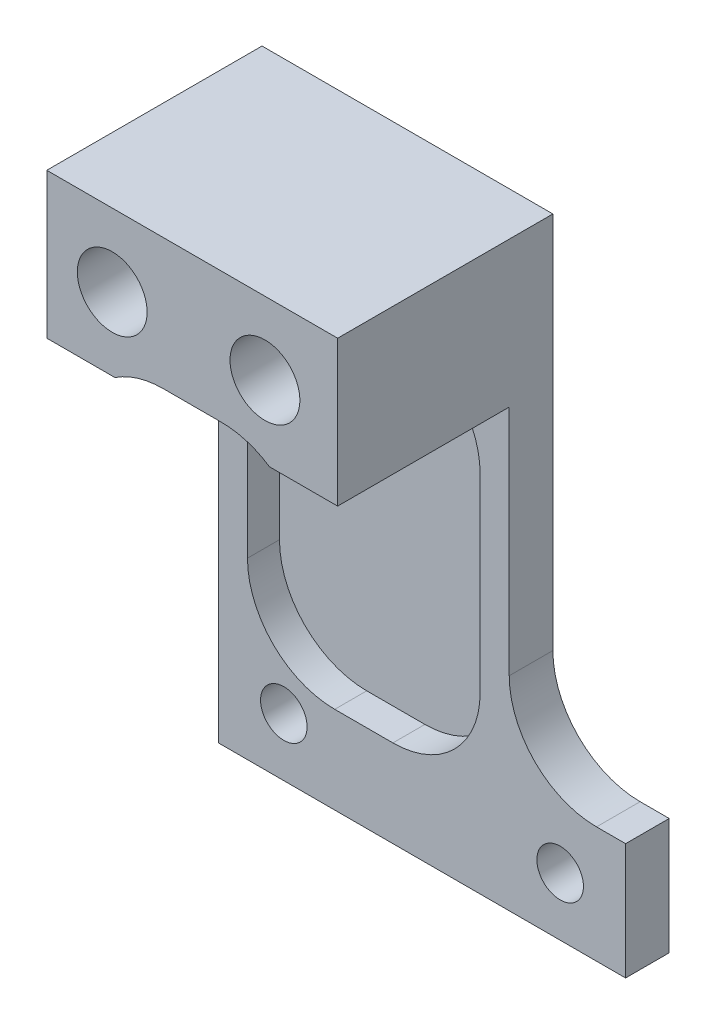
from build123d import *

# Parameters (mm, degrees)
SKETCH1_W                                           = 14
SKETCH1_H                                           = 20
BOSS_EXTRUDE1_DEPTH                                 = 1.5
SKETCH2_W                                           = 14
SKETCH2_H                                           = 5
BOSS_EXTRUDE2_DEPTH                                 = 5.9
M2_TAPPED_HOLE1_D                                   = 1.6
M2_TAPPED_HOLE1_DEPTH                               = 6
M2_TAPPED_HOLE1_TIP                                 = 0.480688495
CUT_EXTRUDE6_DEPTH                                  = 15.274452704
CBORE_FOR_M2_HEX_SOCKET_HEAD_CAP_SCREW1_D           = 2.4
CBORE_FOR_M2_HEX_SOCKET_HEAD_CAP_SCREW1_DEPTH       = 7.5
CBORE_FOR_M2_HEX_SOCKET_HEAD_CAP_SCREW1_CBORE_D     = 4.4
CBORE_FOR_M2_HEX_SOCKET_HEAD_CAP_SCREW1_CBORE_DEPTH = 2.4
CBORE_FOR_M2_HEX_SOCKET_HEAD_CAP_SCREW1_TIP         = 0.721032743
CUT_EXTRUDE7_DEPTH                                  = 7


with BuildPart() as part:
    # Sketch1 → Boss-Extrude1 (new body)
    with BuildSketch(Plane.XY):
        Rectangle(SKETCH1_W, SKETCH1_H)
    extrude(amount=BOSS_EXTRUDE1_DEPTH)

    # Sketch2 → Boss-Extrude2 (add)
    with BuildSketch(Plane.XY.offset(1.5)):
        with Locations((0, 7.5)):
            Rectangle(SKETCH2_W, SKETCH2_H)
    extrude(amount=BOSS_EXTRUDE2_DEPTH)

    # M2 Tapped Hole1
    with Locations(Plane(origin=(-4.75, -8, 0), x_dir=(-1, 0, 0), z_dir=(0, 0, -1))):
        with Locations((0, 0), (-9.5, 0)):
            Hole(M2_TAPPED_HOLE1_D / 2, depth=M2_TAPPED_HOLE1_DEPTH)
            with Locations((0, 0, -(M2_TAPPED_HOLE1_DEPTH + M2_TAPPED_HOLE1_TIP / 2))):  # 118° drill point
                Cone(0, M2_TAPPED_HOLE1_D / 2, M2_TAPPED_HOLE1_TIP, mode=Mode.SUBTRACT)

    # Sketch11 → Cut-Extrude6 (cut, through all)
    with BuildSketch(Plane.XY.offset(7.4)):
        with BuildLine():
            Line((7, -6), (6, -6))
            ThreePointArc((6, -6), (3.878679656, -5.121320344), (3, -3))
            Line((3, -3), (3, 10))
            Line((3, 10), (7, 10))
            Line((7, 10), (7, -6))
        make_face()
    extrude(amount=-CUT_EXTRUDE6_DEPTH, mode=Mode.SUBTRACT)

    # CBORE for M2 Hex Socket Head Cap Screw1
    with Locations(Plane(origin=(-4.75, 7.5, 0), x_dir=(-1, 0, 0), z_dir=(0, 0, -1))):
        with Locations((0, 0), (-5.25, 0)):
            CounterBoreHole(CBORE_FOR_M2_HEX_SOCKET_HEAD_CAP_SCREW1_D / 2, CBORE_FOR_M2_HEX_SOCKET_HEAD_CAP_SCREW1_CBORE_D / 2, CBORE_FOR_M2_HEX_SOCKET_HEAD_CAP_SCREW1_CBORE_DEPTH, depth=CBORE_FOR_M2_HEX_SOCKET_HEAD_CAP_SCREW1_DEPTH)
            with Locations((0, 0, -(CBORE_FOR_M2_HEX_SOCKET_HEAD_CAP_SCREW1_DEPTH + CBORE_FOR_M2_HEX_SOCKET_HEAD_CAP_SCREW1_TIP / 2))):  # 118° drill point
                Cone(0, CBORE_FOR_M2_HEX_SOCKET_HEAD_CAP_SCREW1_D / 2, CBORE_FOR_M2_HEX_SOCKET_HEAD_CAP_SCREW1_TIP, mode=Mode.SUBTRACT)

    # Sketch14 → Cut-Extrude7 (cut)
    with BuildSketch(Plane.XY.offset(7.4)):
        with BuildLine():
            Line((-3, 5.5), (-1, 5.5))
            ThreePointArc((-1, 5.5), (1.121320344, 4.621320344), (2, 2.5))
            Line((2, 2.5), (2, -4))
            ThreePointArc((2, -4), (1.121320344, -6.121320344), (-1, -7))
            Line((-1, -7), (-3, -7))
            ThreePointArc((-3, -7), (-5.121320344, -6.121320344), (-6, -4))
            Line((-6, -4), (-6, 2.5))
            ThreePointArc((-6, 2.5), (-5.121320344, 4.621320344), (-3, 5.5))
        make_face()
    extrude(amount=-CUT_EXTRUDE7_DEPTH, mode=Mode.SUBTRACT)


solid = part.part
